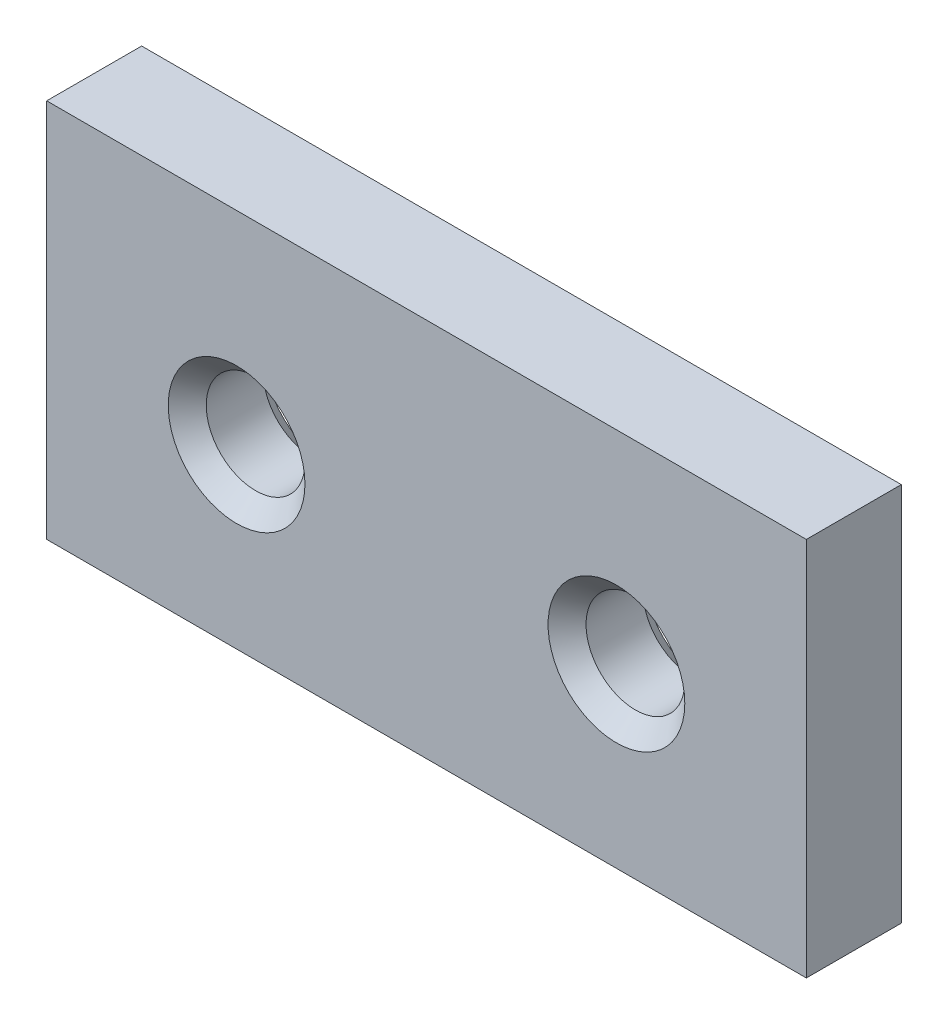
from build123d import *

# Parameters (mm, degrees)
IZIM1_W                     = 40
IZIM1_H                     = 20
Y_KSEKLIK_EKSTR_ZYON1_DEPTH = 5
IZIM2_R                     = 2.6
KES_EKSTR_ZYON1_DEPTH       = 5
PAH1_SIZE                   = 1


with BuildPart() as part:
    # Çizim1 → Yükseklik-Ekstrüzyon1 (new body)
    with BuildSketch(Plane.XY):
        with Locations((-51.29829922, 6.046511628)):
            Rectangle(IZIM1_W, IZIM1_H)
    extrude(amount=Y_KSEKLIK_EKSTR_ZYON1_DEPTH)

    # Çizim2 → Kes-Ekstrüzyon1 (cut)
    with BuildSketch(Plane.XY.offset(5)):
        with Locations((-61.29829922, 5.367137417)):
            Circle(IZIM2_R)
        with Locations((-41.29829922, 5.367137417)):
            Circle(IZIM2_R)
    extrude(amount=-KES_EKSTR_ZYON1_DEPTH, mode=Mode.SUBTRACT)

    # Pah1
    pah1_edges = [part.edges().sort_by_distance(p)[0] for p in [
        (-63.89829922, 5.367137417, 0),
        (-63.89829922, 5.367137417, 5),
        (-43.89829922, 5.367137417, 0),
        (-43.89829922, 5.367137417, 5),
    ]]
    chamfer(pah1_edges, length=PAH1_SIZE)


solid = part.part
